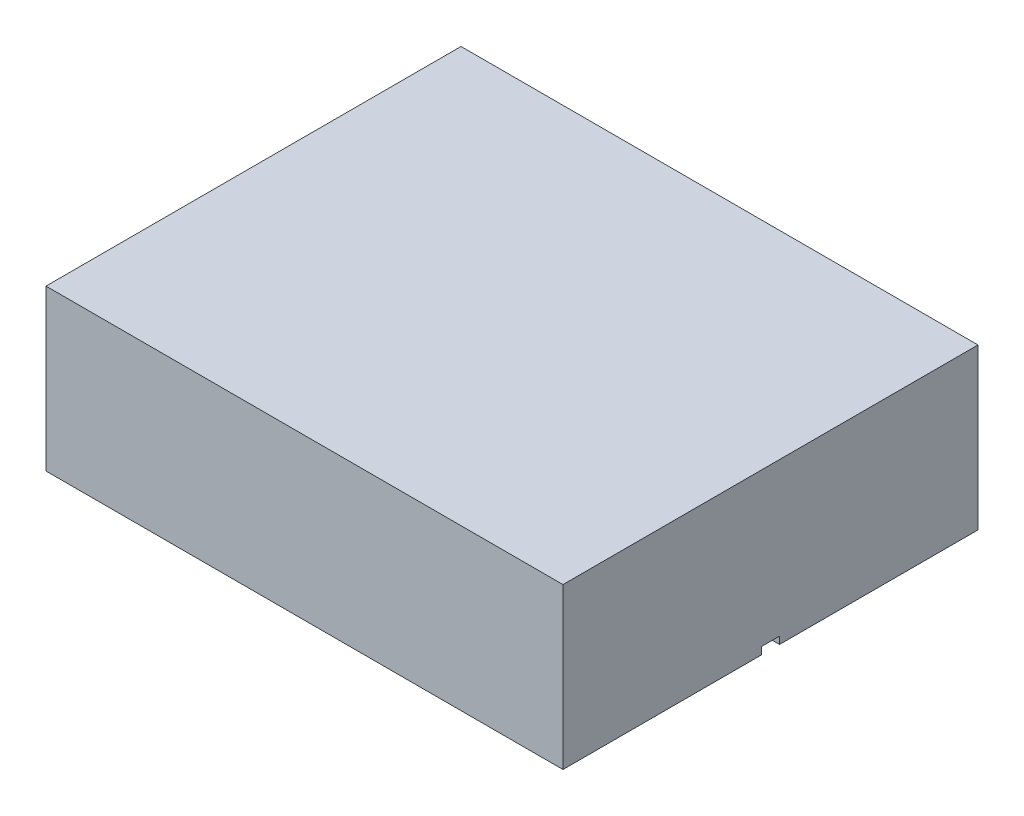
from build123d import *

# Parameters (mm, degrees)
SKETCH2_W           = 180.34
SKETCH2_H           = 144.78
BOSS_EXTRUDE1_DEPTH = 55.88
CUT_EXTRUDE2_DEPTH  = 2.54
SKETCH3_R           = 2.54
CUT_EXTRUDE1_DEPTH  = 2.54


with BuildPart() as part:
    # Sketch2 → Boss-Extrude1 (new body)
    with BuildSketch(Plane(origin=(0, 0, 0), x_dir=(1, 0, 0), z_dir=(0, 1, 0))):
        with Locations((90.17, 72.39)):
            Rectangle(SKETCH2_W, SKETCH2_H)
    extrude(amount=BOSS_EXTRUDE1_DEPTH)

    # Sketch4 → Cut-Extrude2 (cut)
    with BuildSketch(Plane.XZ):
        with BuildLine():
            Line((0, -69.215), (2.54, -69.215))
            ThreePointArc((2.54, -69.215), (5.715, -72.39), (2.54, -75.565))
            Line((2.54, -75.565), (0, -75.565))
            ThreePointArc((0, -75.565), (-3.175, -72.39), (0, -69.215))
        make_face()
        with BuildLine():
            Line((180.34, -69.215), (177.8, -69.215))
            ThreePointArc((177.8, -69.215), (174.625, -72.39), (177.8, -75.565))
            Line((177.8, -75.565), (180.34, -75.565))
            ThreePointArc((180.34, -75.565), (183.515, -72.39), (180.34, -69.215))
        make_face()
    extrude(amount=-CUT_EXTRUDE2_DEPTH, mode=Mode.SUBTRACT)

    # Sketch3 → Cut-Extrude1 (cut)
    with BuildSketch(Plane.XZ):
        with Locations(Location((13.382501665, -72.39, 0), (0, 0, 270))):
            Circle(SKETCH3_R)
        with Locations(Location((166.957498335, -72.39, 0), (0, 0, 270))):
            Circle(SKETCH3_R)
    extrude(amount=-CUT_EXTRUDE1_DEPTH, mode=Mode.SUBTRACT)


solid = part.part
